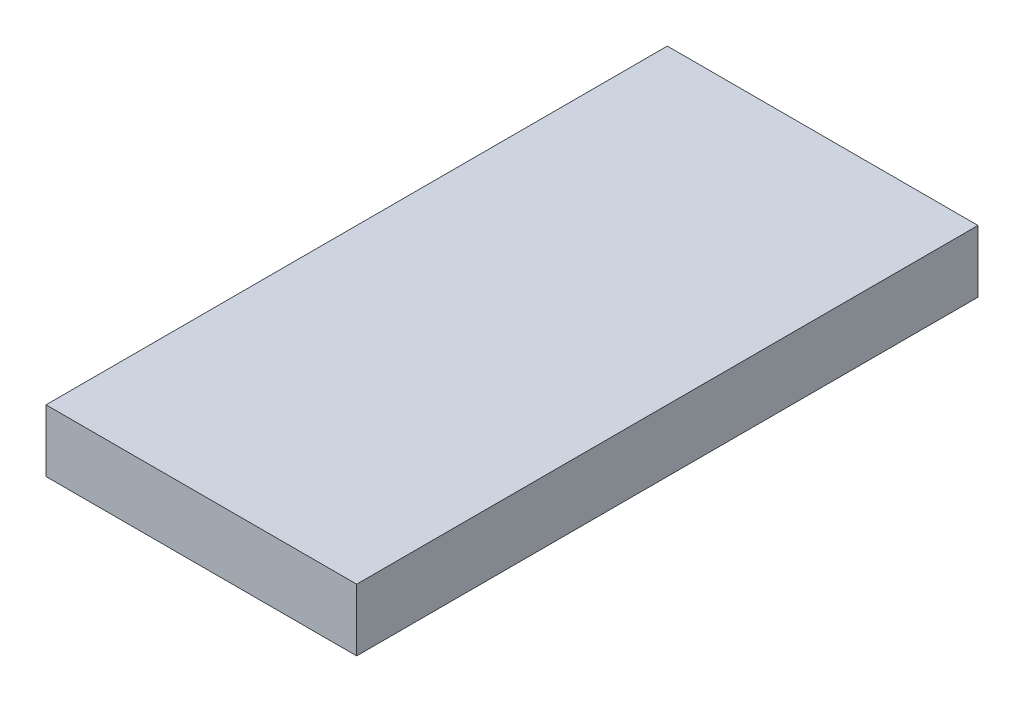
from build123d import *

# Parameters (mm, degrees)
SKETCH_1_W      = 60
SKETCH_1_H      = 120
EXTRUDE_1_DEPTH = 12


with BuildPart() as part:
    # 草圖1 → 擠出1 (new body)
    with BuildSketch(Plane(origin=(0, 0, 0), x_dir=(-1, 0, 0), z_dir=(0, 1, 0))):
        Rectangle(SKETCH_1_W, SKETCH_1_H)
    extrude(amount=EXTRUDE_1_DEPTH)


solid = part.part
